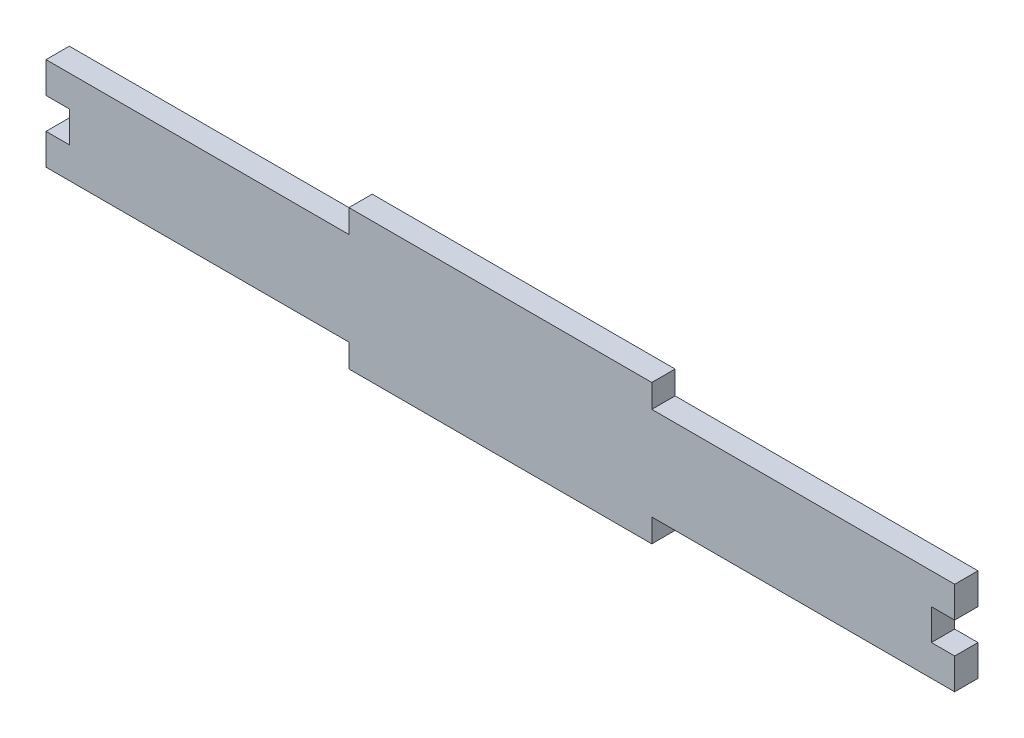
from build123d import *

# Parameters (mm, degrees)
BOSS_EXTRUDE1_DEPTH = 3


with BuildPart() as part:
    # Sketch1 → Boss-Extrude1 (new body)
    with BuildSketch(Plane.XY):
        Polygon((-19.5, -9), (19.5, -9), (19.5, -6), (58.5, -6), (58.5, -2), (55.5, -2), (55.5, 2), (58.5, 2), (58.5, 6), (19.5, 6), (19.5, 9), (-19.5, 9), (-19.5, 6), (-58.5, 6), (-58.5, 2), (-55.5, 2), (-55.5, -2), (-58.5, -2), (-58.5, -6), (-19.5, -6), align=None)
    extrude(amount=BOSS_EXTRUDE1_DEPTH)


solid = part.part
